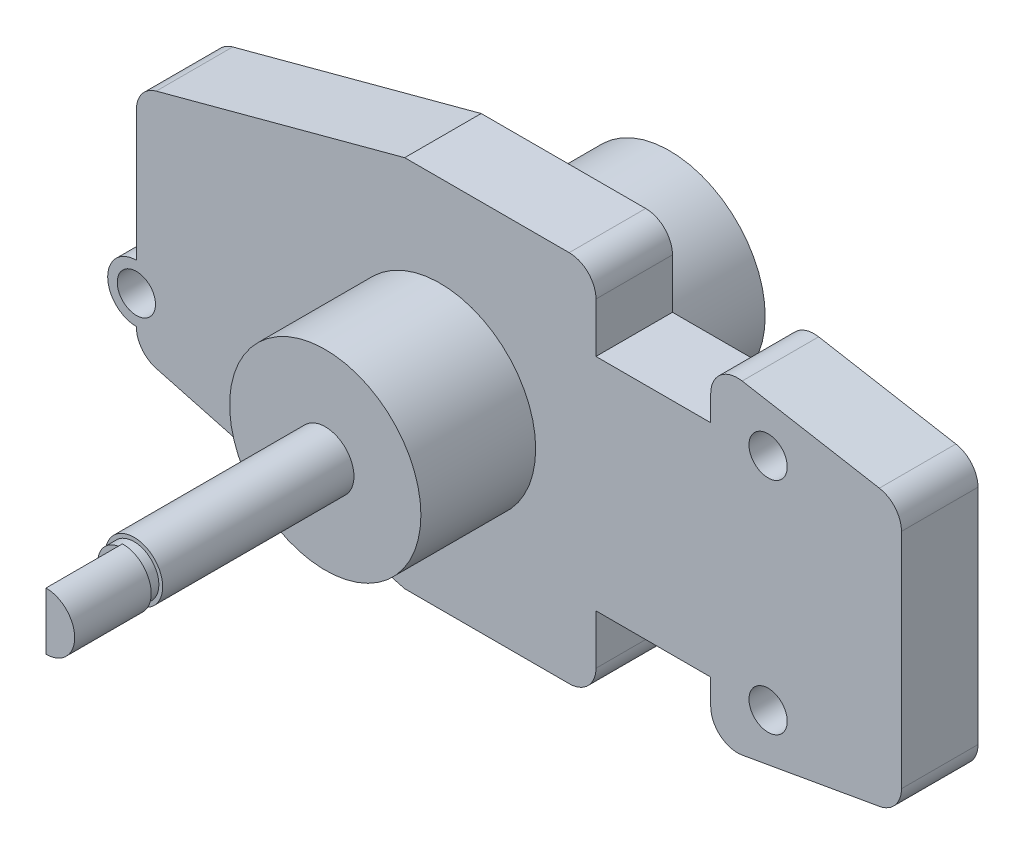
from build123d import *

# Parameters (mm, degrees)
BOSS_EXTRUDE1_DEPTH      = 2
SKETCH3_R                = 0.5
CUT_EXTRUDE1_DEPTH       = 2
SKETCH4_R                = 0.75
BOSS_EXTRUDE2_DEPTH      = 1
SKETCH5_R                = 0.5
CUT_EXTRUDE2_DEPTH       = 2
BOSS_EXTRUDE3_DEPTH      = 3
BOSS_EXTRUDE3_DEPTH_BACK = 6
SKETCH6_R                = 2.5
SKETCH7_R                = 0.75
BOSS_EXTRUDE4_DEPTH      = 5
SKETCH9_R                = 0.65
BOSS_EXTRUDE5_DEPTH      = 0.3
BOSS_EXTRUDE6_DEPTH      = 2


with BuildPart() as part:
    # Sketch2 → Boss-Extrude1 (new body)
    with BuildSketch(Plane.XY):
        with BuildLine():
            Line((-7.9375, -2.462871108), (-7.9375, 2.462871108))
            ThreePointArc((-7.9375, 2.462871108), (-7.792847338, 2.889004109), (-7.418673332, 3.139019187))
            Line((-7.418673332, 3.139019187), (-0.924016143, 4.879257336))
            Line((-0.924016143, 4.879257336), (3.375983857, 4.879257336))
            ThreePointArc((3.375983857, 4.879257336), (3.870958604, 4.674232083), (4.075983857, 4.179257336))
            Line((4.075983857, 4.179257336), (4.075983857, 2.879257336))
            Line((4.075983857, 2.879257336), (7.075983857, 2.879257336))
            Line((7.075983857, 2.879257336), (7.075983857, 3.545029821))
            ThreePointArc((7.075983857, 3.545029821), (7.326032531, 4.081260931), (7.897537582, 4.234395248))
            Line((7.897537582, 4.234395248), (11.484053724, 3.601995685))
            ThreePointArc((11.484053724, 3.601995685), (11.89873111, 3.362581585), (12.0625, 2.912630258))
            Line((12.0625, 2.912630258), (12.0625, -2.912630258))
            ThreePointArc((12.0625, -2.912630258), (11.89873111, -3.362581585), (11.484053724, -3.601995685))
            Line((11.484053724, -3.601995685), (7.897537582, -4.234395248))
            ThreePointArc((7.897537582, -4.234395248), (7.326032531, -4.081260931), (7.075983857, -3.545029821))
            Line((7.075983857, -3.545029821), (7.075983857, -2.879257336))
            Line((7.075983857, -2.879257336), (4.075983857, -2.879257336))
            Line((4.075983857, -2.879257336), (4.075983857, -4.179257336))
            ThreePointArc((4.075983857, -4.179257336), (3.870958604, -4.674232083), (3.375983857, -4.879257336))
            Line((3.375983857, -4.879257336), (-0.924016143, -4.879257336))
            Line((-0.924016143, -4.879257336), (-7.418673332, -3.139019187))
            ThreePointArc((-7.418673332, -3.139019187), (-7.792847338, -2.889004109), (-7.9375, -2.462871108))
        make_face()
    extrude(amount=BOSS_EXTRUDE1_DEPTH)

    # Sketch3 → Cut-Extrude1 (cut)
    with BuildSketch(Plane.XY.offset(2)):
        with Locations((8.575983857, 2.879257336)):
            Circle(SKETCH3_R)
        with Locations((8.575983857, -2.879257336)):
            Circle(SKETCH3_R)
    extrude(amount=-CUT_EXTRUDE1_DEPTH, mode=Mode.SUBTRACT)

    # Sketch4 → Boss-Extrude2 (add)
    with BuildSketch(Plane.XY.offset(2)):
        with Locations((-7.9375, -1.7)):
            Circle(SKETCH4_R)
    extrude(amount=-BOSS_EXTRUDE2_DEPTH)

    # Sketch5 → Cut-Extrude2 (cut)
    with BuildSketch(Plane.XY.offset(2)):
        with Locations((-7.9375, -1.7)):
            Circle(SKETCH5_R)
    extrude(amount=-CUT_EXTRUDE2_DEPTH, mode=Mode.SUBTRACT)

    # Sketch6 → Boss-Extrude3 (add, two sides: drawn at the far end of the back side and taken through both)
    with BuildSketch(Plane.XY.offset(2).offset(-BOSS_EXTRUDE3_DEPTH_BACK)):
        Circle(SKETCH6_R)
    extrude(amount=BOSS_EXTRUDE3_DEPTH + BOSS_EXTRUDE3_DEPTH_BACK)

    # Sketch7 → Boss-Extrude4 (add)
    with BuildSketch(Plane.XY.offset(5)):
        Circle(SKETCH7_R)
    extrude(amount=BOSS_EXTRUDE4_DEPTH)

    # Sketch9 → Boss-Extrude5 (add)
    with BuildSketch(Plane.XY.offset(10)):
        Circle(SKETCH9_R)
    extrude(amount=BOSS_EXTRUDE5_DEPTH)

    # Sketch10 → Boss-Extrude6 (add)
    with BuildSketch(Plane.XY.offset(10.3)):
        with BuildLine():
            Line((0, 0.75), (0, -0.75))
            ThreePointArc((0, -0.75), (0.75, 0), (0, 0.75))
        make_face()
    extrude(amount=BOSS_EXTRUDE6_DEPTH)


solid = part.part
